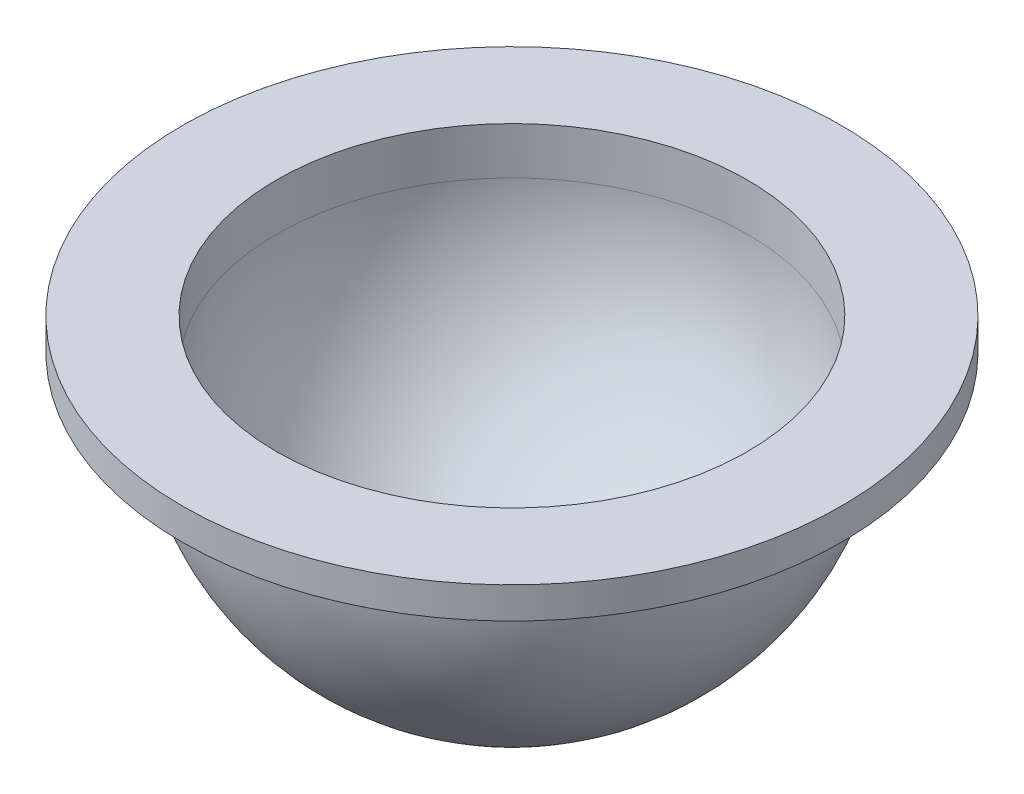
from build123d import *


with BuildPart() as part:
    # Sketch1 → Revolve1 (revolve)
    with BuildSketch(Plane(origin=(0, 0, 0), x_dir=(0, 0, -1), z_dir=(1, 0, 0))):
        with BuildLine():
            Line((0, 0), (0, -2))
            Line((0, -2), (4, -2))
            Line((4, -2), (4, -3))
            ThreePointArc((4, -3), (8.97918472, -15.02081528), (21, -20))
            Line((21, -20), (21, -18))
            ThreePointArc((21, -18), (10.393398282, -13.606601718), (6, -3))
            Line((6, -3), (6, 0))
            Line((6, 0), (0, 0))
        make_face()
    revolve(axis=Axis((0, 28.13029526, -21), (0, -1, 0)))


solid = part.part
